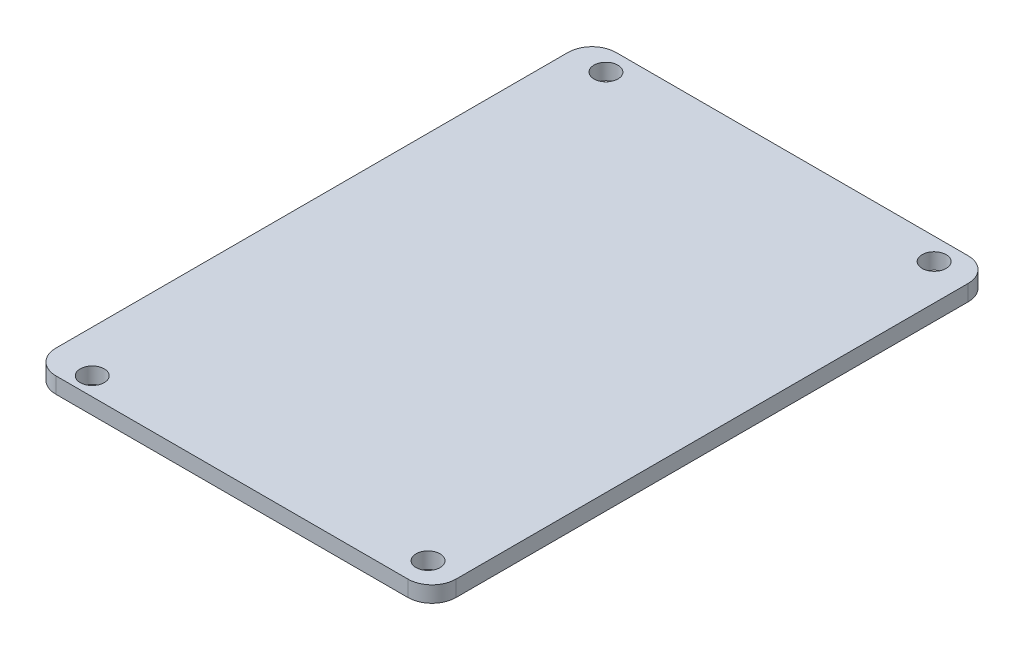
from build123d import *

# Parameters (mm, degrees)
SKETCH_1_W      = 50
SKETCH_1_H      = 70
SKETCH_1_R      = 1.5
EXTRUDE_1_DEPTH = 2
FILLET_1_R      = 3


with BuildPart() as part:
    # 草图1 → 凸台-拉伸1 (new body)
    with BuildSketch(Plane(origin=(0, 0, 0), x_dir=(1, 0, 0), z_dir=(0, 1, 0))):
        Rectangle(SKETCH_1_W, SKETCH_1_H)
        with Locations(Location((20.505712162, 32.246478585, 0), (0, 0, 270))):
            Circle(SKETCH_1_R, mode=Mode.SUBTRACT)
        with Locations(Location((-20.505712162, 32.246478585, 0), (0, 0, 90))):
            Circle(SKETCH_1_R, mode=Mode.SUBTRACT)
        with Locations(Location((21.261079234, -31.753521415, 0), (0, 0, 90))):
            Circle(SKETCH_1_R, mode=Mode.SUBTRACT)
        with Locations(Location((-19.738920766, -32.721470313, 0), (0, 0, 270))):
            Circle(SKETCH_1_R, mode=Mode.SUBTRACT)
    extrude(amount=EXTRUDE_1_DEPTH)

    # 圆角1
    fillet_1_edges = [part.edges().sort_by_distance(p)[0] for p in [
        (25, 1, 35),
        (-25, 1, 35),
        (-25, 1, -35),
        (25, 1, -35),
    ]]
    fillet(fillet_1_edges, radius=FILLET_1_R)


solid = part.part
